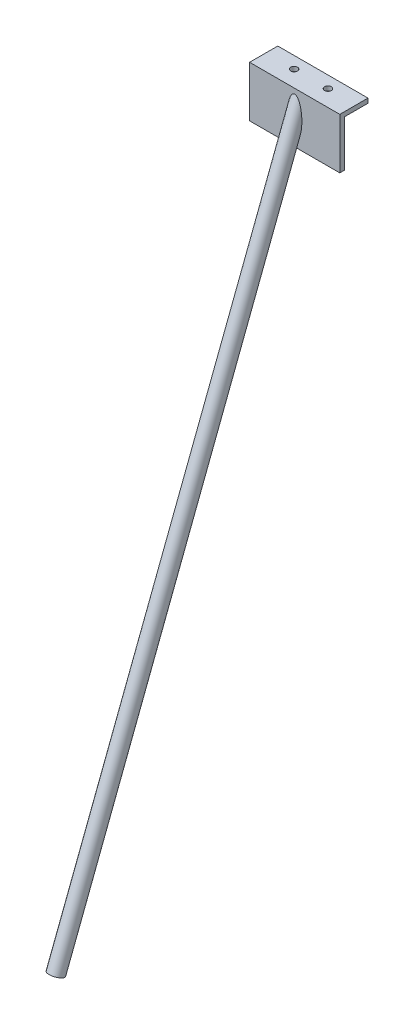
from build123d import *

# Parameters (mm, degrees)
BOSS_EXTRUDE1_DEPTH             = 80
BOSS_EXTRUDE2_REACH             = 99.687
SKETCH2_R                       = 6.375
SKETCH2_R_2                     = 4.9
BOSS_EXTRUDE2_DIRECTION_2_DEPTH = 570
F_6_0MM_DOWEL_HOLE1_D           = 6


with BuildPart() as part:
    # Sketch1 → Boss-Extrude1 (new body)
    with BuildSketch(Plane(origin=(0, 0, 0), x_dir=(0, 0, -1), z_dir=(1, 0, 0))):
        Polygon((0, 0), (25, 0), (25, -4), (4, -4), (4, -45), (0, -45), align=None)
    extrude(amount=BOSS_EXTRUDE1_DEPTH)

    # Boss-Extrude2: up to this plane
    boss_extrude2_end = Plane(origin=(80, -45, 0), z_dir=(0, 0, -1))
    # Sketch2 → Boss-Extrude2 (add, up to the surface)
    with BuildSketch(Plane(origin=(0, -39.220758573, 15.055438643), x_dir=(-1, 0, 0), z_dir=(0, 0.9335804264972002, -0.3583679495453042)), mode=Mode.PRIVATE) as boss_extrude2_sk1:
        with Locations((-40, -8)):
            Circle(SKETCH2_R)
        with Locations((-40, -8)):
            Circle(SKETCH2_R_2, mode=Mode.SUBTRACT)
    boss_extrude2_tool1 = split(extrude(boss_extrude2_sk1.sketch, amount=BOSS_EXTRUDE2_REACH, mode=Mode.PRIVATE), bisect_by=boss_extrude2_end, keep=Keep.BOTH, mode=Mode.PRIVATE)
    add(boss_extrude2_tool1.solids().sort_by_distance((46.194688, -42.087702, 7.586795))[0])

    # Sketch2 → Boss-Extrude2 direction 2 (add)
    with BuildSketch(Plane(origin=(0, -39.220758573, 15.055438643), x_dir=(-1, 0, 0), z_dir=(0, 0.9335804264972002, -0.3583679495453042))):
        with Locations((-40, -8)):
            Circle(SKETCH2_R)
        with Locations((-40, -8)):
            Circle(SKETCH2_R_2, mode=Mode.SUBTRACT)
    extrude(amount=-BOSS_EXTRUDE2_DIRECTION_2_DEPTH)

    # Ø6.0mm Dowel Hole1 (through all)
    with Locations(Plane(origin=(0, 0, 0), x_dir=(1, 0, 0), z_dir=(0, 1, 0))):
        with Locations((25, 14.5), (55, 14.5)):
            Hole(F_6_0MM_DOWEL_HOLE1_D / 2)


solid = part.part
